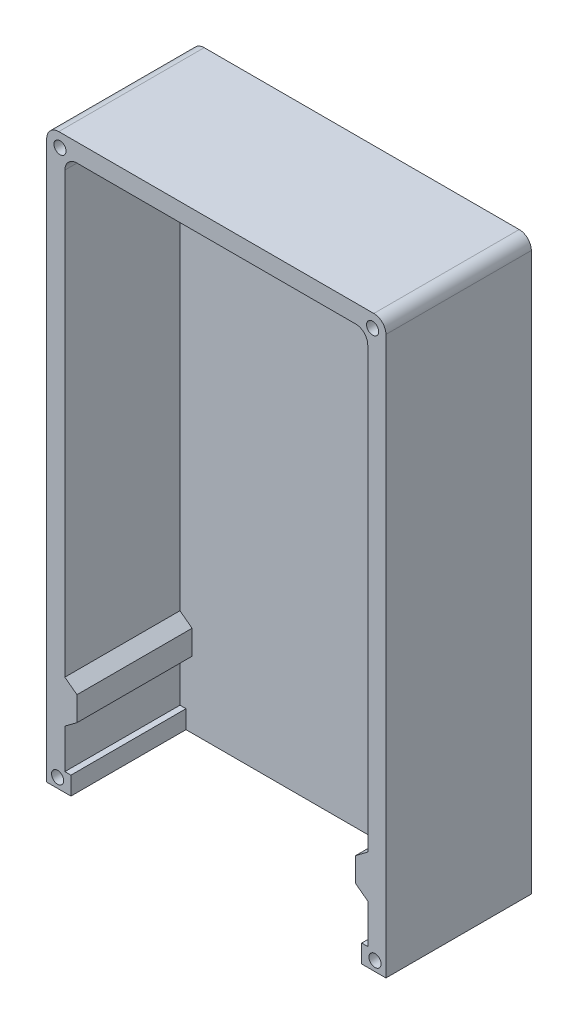
from build123d import *

# Parameters (mm, degrees)
SKIZZE1_W                       = 28
SKIZZE1_H                       = 47
AUFSATZ_LINEAR_AUSTRAGEN1_DEPTH = 12
SCHNITT_LINEAR_AUSTRAGEN1_DEPTH = 9.5
VERRUNDUNG2_R                   = 1
SKIZZE3_R                       = 0.5
SCHNITT_LINEAR_AUSTRAGEN2_DEPTH = 3


with BuildPart() as part:
    # Skizze1 → Aufsatz-Linear austragen1 (new body)
    with BuildSketch(Plane.XY):
        with Locations((14, 23.5)):
            Rectangle(SKIZZE1_W, SKIZZE1_H)
    extrude(amount=AUFSATZ_LINEAR_AUSTRAGEN1_DEPTH)

    # Skizze2 → Schnitt-Linear austragen1 (cut)
    with BuildSketch(Plane.XY.offset(12)):
        with BuildLine():
            Line((2.5, 45.5), (25.5, 45.5))
            ThreePointArc((25.5, 45.5), (26.207106781, 45.207106781), (26.5, 44.5))
            Line((26.5, 44.5), (26.5, 8.251904421))
            Line((26.5, 8.251904421), (25.5, 7.5))
            Line((25.5, 7.5), (25.5, 5.5))
            Line((25.5, 5.5), (26.5, 4.751904421))
            Line((26.5, 4.751904421), (26.5, 1.5))
            Line((26.5, 1.5), (26, 1.5))
            Line((26, 1.5), (26, 0))
            Line((26, 0), (2, 0))
            Line((2, 0), (2, 1.5))
            Line((2, 1.5), (1.5, 1.5))
            Line((1.5, 1.5), (1.5, 4.751904421))
            Line((1.5, 4.751904421), (2.5, 5.5))
            Line((2.5, 5.5), (2.5, 7.5))
            Line((2.5, 7.5), (1.5, 8.251904421))
            Line((1.5, 8.251904421), (1.5, 44.5))
            ThreePointArc((1.5, 44.5), (1.792893219, 45.207106781), (2.5, 45.5))
        make_face()
    extrude(amount=-SCHNITT_LINEAR_AUSTRAGEN1_DEPTH, mode=Mode.SUBTRACT)

    # Verrundung2
    verrundung2_edges = [part.edges().sort_by_distance(p)[0] for p in [
        (0, 47, 6),
        (28, 47, 6),
    ]]
    fillet(verrundung2_edges, radius=VERRUNDUNG2_R)

    # Skizze3 → Schnitt-Linear austragen2 (cut)
    with BuildSketch(Plane.XY.offset(12)):
        with Locations((1.1, 45.9)):
            Circle(SKIZZE3_R)
        with Locations((26.9, 45.9)):
            Circle(SKIZZE3_R)
        with Locations((0.9, 0.8)):
            Circle(SKIZZE3_R)
        with Locations((27.1, 0.8)):
            Circle(SKIZZE3_R)
    extrude(amount=-SCHNITT_LINEAR_AUSTRAGEN2_DEPTH, mode=Mode.SUBTRACT)


solid = part.part
